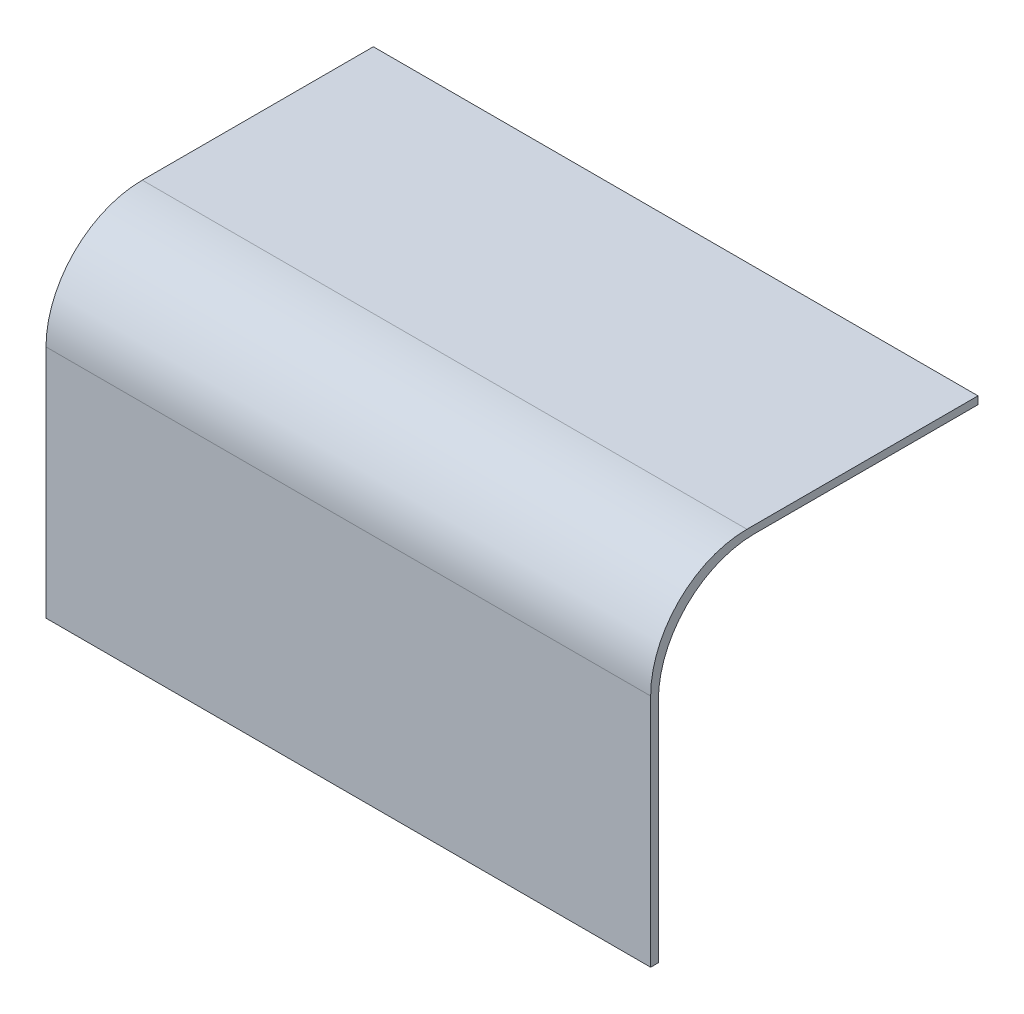
from build123d import *

# Parameters (mm, degrees)
SALIENTE_EXTRUIR1_DEPTH = 314
CORTAR_EXTRUIR1_DEPTH   = 2


with BuildPart() as part:
    # Croquis2 → Saliente-Extruir1 (new body)
    with BuildSketch(Plane(origin=(0, 0, 0), x_dir=(0, 0, -1), z_dir=(1, 0, 0))):
        with BuildLine():
            Line((-38.572123539, -20.408891327), (-38.572123539, 101.591108673))
            ThreePointArc((-38.572123539, 101.591108673), (-23.927462599, 136.946447732), (11.427876461, 151.591108673))
            Line((11.427876461, 151.591108673), (131.427876461, 151.591108673))
            Line((131.427876461, 151.591108673), (131.427876461, 147.591108673))
            Line((131.427876461, 147.591108673), (15.427876461, 147.591108673))
            ThreePointArc((15.427876461, 147.591108673), (-19.927462599, 132.946447732), (-34.572123539, 97.591108673))
            Line((-34.572123539, 97.591108673), (-34.572123539, -20.408891327))
            Line((-34.572123539, -20.408891327), (-38.572123539, -20.408891327))
        make_face()
    extrude(amount=-SALIENTE_EXTRUIR1_DEPTH)

    # Croquis3 → Cortar-Extruir1 (cut)
    with BuildSketch(Plane(origin=(0, 0, 34.572123539), x_dir=(-1, 0, 0), z_dir=(0, 0, -1))):
        Polygon((2, 97.591108673), (2, -18.408891327), (312, -18.408891327), (312, 97.591108673), (308, 97.591108673), (308, -14.408891327), (6, -14.408891327), (6, 97.591108673), align=None)
    extrude(amount=-CORTAR_EXTRUIR1_DEPTH, mode=Mode.SUBTRACT)


solid = part.part
